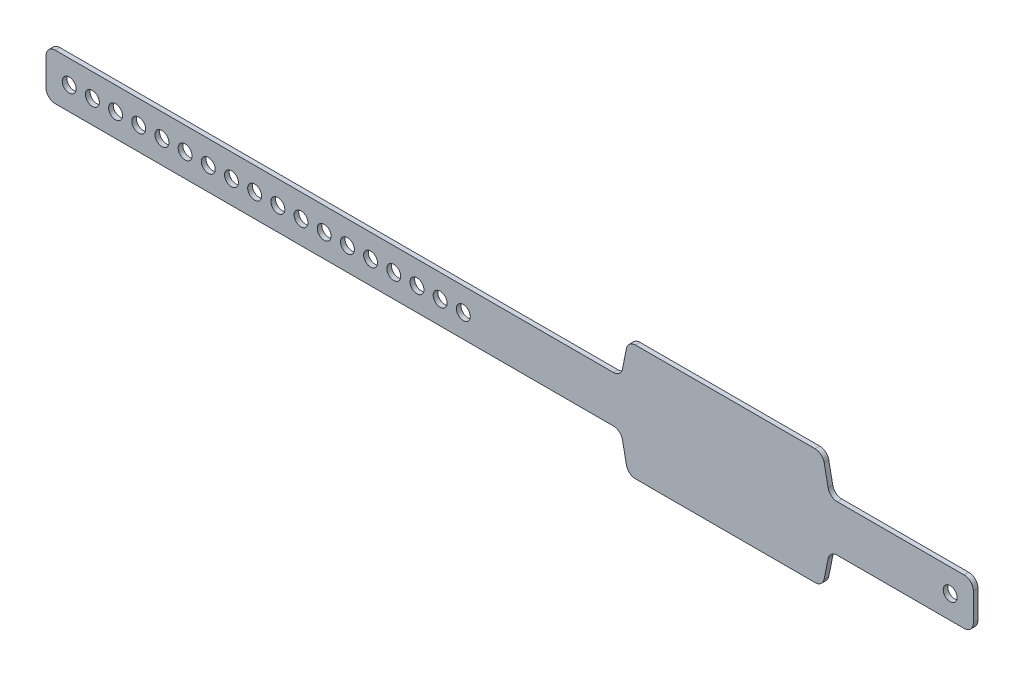
from build123d import *

# Parameters (mm, degrees)
BOSS_EXTRUDE1_DEPTH = 1
BOSS_EXTRUDE2_DEPTH = 1
FILLET1_R           = 2
SKETCH4_R           = 1.5
CUT_EXTRUDE1_DEPTH  = 201.766655598


with BuildPart() as part:
    # Sketch2 → Boss-Extrude1 (new body)
    with BuildSketch(Plane.XY):
        with BuildLine():
            Line((2, 0), (198, 0))
            ThreePointArc((198, 0), (199.414213562, 0.585786438), (200, 2))
            Line((200, 2), (200, 8))
            ThreePointArc((200, 8), (199.414213562, 9.414213562), (198, 10))
            Line((198, 10), (2, 10))
            ThreePointArc((2, 10), (0.585786438, 9.414213562), (0, 8))
            Line((0, 8), (0, 2))
            ThreePointArc((0, 2), (0.585786438, 0.585786438), (2, 0))
        make_face()
    extrude(amount=BOSS_EXTRUDE1_DEPTH)

    # Sketch3 → Boss-Extrude2 (add)
    with BuildSketch(Plane(origin=(0, 0, 0), x_dir=(-1, 0, 0), z_dir=(0, 0, -1))):
        with BuildLine():
            Line((-124, 0), (-125.178446454, -5.89223227))
            ThreePointArc((-125.178446454, -5.89223227), (-125.871629994, -7.046684283), (-127.139607805, -7.5))
            Line((-127.139607805, -7.5), (-165.860392195, -7.5))
            ThreePointArc((-165.860392195, -7.5), (-167.128370006, -7.046684283), (-167.821553546, -5.89223227))
            Line((-167.821553546, -5.89223227), (-169, 0))
            Line((-169, 0), (-124, 0))
        make_face()
        with BuildLine():
            Line((-169, 10), (-124, 10))
            Line((-124, 10), (-125.178446454, 15.89223227))
            ThreePointArc((-125.178446454, 15.89223227), (-125.871629994, 17.046684283), (-127.139607805, 17.5))
            Line((-127.139607805, 17.5), (-165.860392195, 17.5))
            ThreePointArc((-165.860392195, 17.5), (-167.128370006, 17.046684283), (-167.821553546, 15.89223227))
            Line((-167.821553546, 15.89223227), (-169, 10))
        make_face()
    extrude(amount=-BOSS_EXTRUDE2_DEPTH)

    # Fillet1
    fillet1_edges = [part.edges().sort_by_distance(p)[0] for p in [
        (169, 0, 0.5),
        (124, 0, 0.5),
        (124, 10, 0.5),
        (169, 10, 0.5),
    ]]
    fillet(fillet1_edges, radius=FILLET1_R)

    # Sketch4 → Cut-Extrude1 (cut, through all)
    with BuildSketch(Plane(origin=(0, 0, 0), x_dir=(-1, 0, 0), z_dir=(0, 0, -1))):
        with Locations((-5, 5)):
            Circle(SKETCH4_R)
        with Locations((-10, 5)):
            Circle(SKETCH4_R)
        with Locations((-15, 5)):
            Circle(SKETCH4_R)
        with Locations((-20, 5)):
            Circle(SKETCH4_R)
        with Locations((-25, 5)):
            Circle(SKETCH4_R)
        with Locations((-30, 5)):
            Circle(SKETCH4_R)
        with Locations((-195, 5)):
            Circle(SKETCH4_R)
        with Locations((-35, 5)):
            Circle(SKETCH4_R)
        with Locations((-40, 5)):
            Circle(SKETCH4_R)
        with Locations((-45, 5)):
            Circle(SKETCH4_R)
        with Locations((-50, 5)):
            Circle(SKETCH4_R)
        with Locations((-55, 5)):
            Circle(SKETCH4_R)
        with Locations((-60, 5)):
            Circle(SKETCH4_R)
        with Locations((-65, 5)):
            Circle(SKETCH4_R)
        with Locations((-70, 5)):
            Circle(SKETCH4_R)
        with Locations((-75, 5)):
            Circle(SKETCH4_R)
        with Locations((-80, 5)):
            Circle(SKETCH4_R)
        with Locations((-85, 5)):
            Circle(SKETCH4_R)
        with Locations((-90, 5)):
            Circle(SKETCH4_R)
    extrude(amount=-CUT_EXTRUDE1_DEPTH, mode=Mode.SUBTRACT)


solid = part.part
